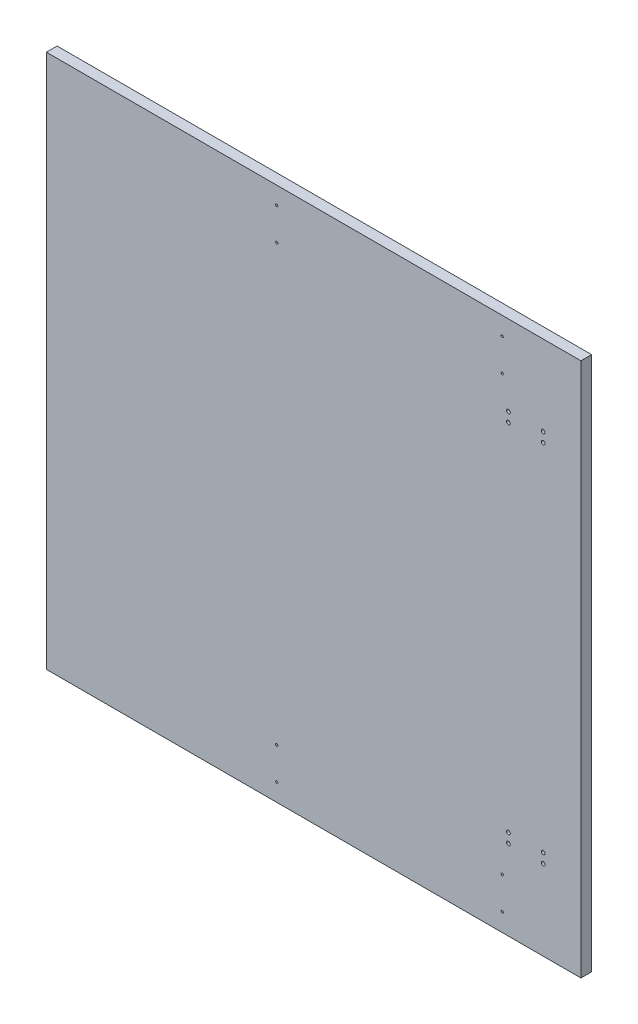
from build123d import *

# Parameters (mm, degrees)
SKETCH5_W             = 1000
SKETCH5_H             = 1000
BOSS_EXTRUDE1_DEPTH   = 20
M8X1_0_TAPPED_HOLE1_D = 7
M5X0_8_TAPPED_HOLE1_D = 4.2


with BuildPart() as part:
    # Sketch5 → Boss-Extrude1 (new body)
    with BuildSketch(Plane.XY):
        Rectangle(SKETCH5_W, SKETCH5_H)
    extrude(amount=BOSS_EXTRUDE1_DEPTH)

    # M8x1.0 Tapped Hole1 (through all)
    with Locations(Plane(origin=(364.35, 350, 20), x_dir=(1, 0, 0), z_dir=(0, 0, 1))):
        with Locations((0, 0), (0, -18), (65, -18), (65, 0)):
            m8x1_0_tapped_hole1 = Hole(M8X1_0_TAPPED_HOLE1_D / 2)

    # M5x0.8 Tapped Hole1 (through all)
    with Locations(Plane(origin=(-69.09, 406.8375, 20), x_dir=(1, 0, 0), z_dir=(0, 0, 1))):
        with Locations((0, 0), (0, 60.325), (421.894, 59.325), (421.894, -1)):
            m5x0_8_tapped_hole1 = Hole(M5X0_8_TAPPED_HOLE1_D / 2)

    # Mirror1: M8x1.0 Tapped Hole1, M5x0.8 Tapped Hole1 across plane
    add(m8x1_0_tapped_hole1.mirror(Plane.ZX), mode=Mode.SUBTRACT)
    add(m5x0_8_tapped_hole1.mirror(Plane.ZX), mode=Mode.SUBTRACT)


solid = part.part
